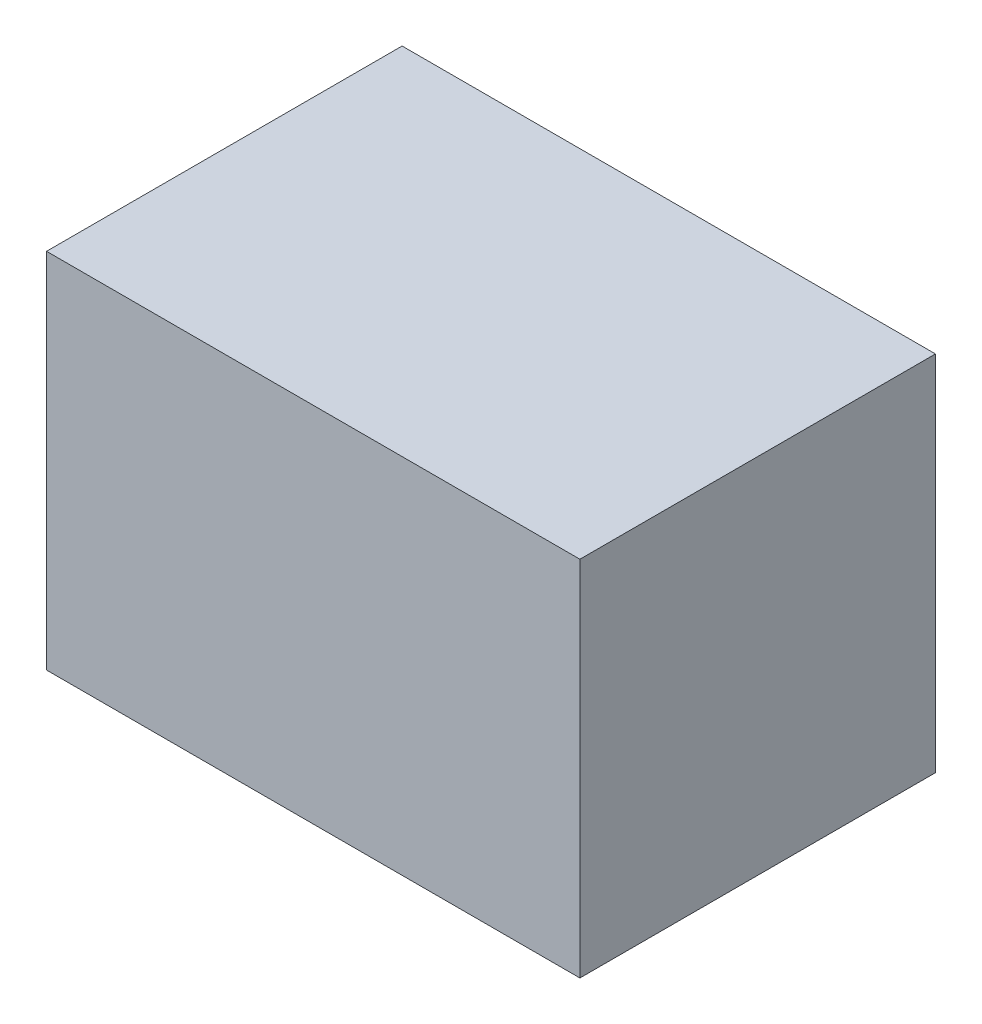
from build123d import *

# Parameters (mm, degrees)
SKETCH1_W           = 150
SKETCH1_H           = 100
BOSS_EXTRUDE1_DEPTH = 100
SHELL1_T            = -2
SKETCH3_W           = 73
SKETCH3_H           = 2
SKETCH3_W_2         = 2
SKETCH3_H_2         = 96
EXTRUDE_THIN1_DEPTH = 98
SKETCH4_R           = 15
SKETCH4_R_2         = 13.5
BOSS_EXTRUDE2_DEPTH = 75
SKETCH6_R           = 6.25
SKETCH7_R           = 6.25
SKETCH11_R          = 6.25
SKETCH11_R_2        = 5
BOSS_EXTRUDE3_DEPTH = 5
SKETCH12_R          = 6.25
BOSS_EXTRUDE4_DEPTH = 5
SKETCH13_W          = 150
SKETCH13_H          = 100
BOSS_EXTRUDE5_DEPTH = 2


with BuildPart() as part:
    # Sketch1 → Boss-Extrude1 (new body)
    with BuildSketch(Plane(origin=(0, 0, 0), x_dir=(1, 0, 0), z_dir=(0, 1, 0))):
        Rectangle(SKETCH1_W, SKETCH1_H)
    extrude(amount=BOSS_EXTRUDE1_DEPTH)

    # Shell1
    shell1_openings = [part.faces().sort_by_distance(p)[0] for p in [
        (0, 100, 0),
    ]]
    offset(amount=SHELL1_T, openings=shell1_openings, kind=Kind.INTERSECTION)

    # Sketch3 → Extrude-Thin1 (add, through all)
    with BuildSketch(Plane(origin=(0, 2, 0), x_dir=(1, 0, 0), z_dir=(0, 1, 0))):
        with Locations((-36.5, -1)):
            Rectangle(SKETCH3_W, SKETCH3_H)
        with Locations((-55.75, 0)):
            Rectangle(SKETCH3_W_2, SKETCH3_H_2)
        with Locations((-37.5, 0)):
            Rectangle(SKETCH3_W_2, SKETCH3_H_2)
        with Locations((-1, 0)):
            Rectangle(SKETCH3_W_2, SKETCH3_H_2)
        with Locations((-19.25, 0)):
            Rectangle(SKETCH3_W_2, SKETCH3_H_2)
        with Locations((35.5, 0)):
            Rectangle(SKETCH3_W_2, SKETCH3_H_2)
    extrude(amount=EXTRUDE_THIN1_DEPTH)

    # Sketch4 → Boss-Extrude2 (add)
    # profile 1 of 4: a face of its own
    with BuildSketch(Plane(origin=(0, 0, 48), x_dir=(-1, 0, 0), z_dir=(0, 0, -1))):
        with Locations((-17, 67)):
            Circle(SKETCH4_R)
        with Locations((-17, 67)):
            Circle(SKETCH4_R_2, mode=Mode.SUBTRACT)
    # profile 2 of 4: a face of its own
    with BuildSketch(Plane(origin=(0, 0, 48), x_dir=(-1, 0, 0), z_dir=(0, 0, -1))):
        with Locations((-55.5, 67)):
            Circle(SKETCH4_R)
        with Locations((-55.5, 67)):
            Circle(SKETCH4_R_2, mode=Mode.SUBTRACT)
    # profile 3 of 4: a face of its own
    with BuildSketch(Plane(origin=(0, 0, 48), x_dir=(-1, 0, 0), z_dir=(0, 0, -1))):
        with Locations((-17, 22)):
            Circle(SKETCH4_R)
        with Locations((-17, 22)):
            Circle(SKETCH4_R_2, mode=Mode.SUBTRACT)
    # profile 4 of 4: a face of its own
    with BuildSketch(Plane(origin=(0, 0, 48), x_dir=(-1, 0, 0), z_dir=(0, 0, -1))):
        with Locations((-55.5, 22)):
            Circle(SKETCH4_R)
        with Locations((-55.5, 22)):
            Circle(SKETCH4_R_2, mode=Mode.SUBTRACT)
    extrude(amount=BOSS_EXTRUDE2_DEPTH)

    # Sketch6 → section 0 of loft2
    with BuildSketch(Plane.XY.offset(-35), mode=Mode.PRIVATE) as loft2_s0:
        with Locations((17, 67)):
            Circle(SKETCH6_R)
    # loft up to a face of the part (loft2)
    loft([loft2_s0.sketch, Face(Wire([part.edges().sort_by_distance((27.268206589, 77.934529411, -27))[0]]))])

    # Sketch7 → section 1 of loft3
    with BuildSketch(Plane.XY.offset(-35), mode=Mode.PRIVATE) as loft3_s1:
        with Locations((55.5, 67)):
            Circle(SKETCH7_R)
    # loft up to a face of the part (loft3)
    loft([Face(Wire([part.edges().sort_by_distance((65.768206589, 77.934529411, -27))[0]])), loft3_s1.sketch])

    # Sketch11 → Boss-Extrude3 (add)
    with BuildSketch(Plane(origin=(0, 0, -35), x_dir=(-1, 0, 0), z_dir=(0, 0, -1))):
        with Locations((-17, 67)):
            Circle(SKETCH11_R)
        with Locations((-17, 67)):
            Circle(SKETCH11_R_2, mode=Mode.SUBTRACT)
    extrude(amount=BOSS_EXTRUDE3_DEPTH)

    # Sketch12 → Boss-Extrude4 (add)
    with BuildSketch(Plane(origin=(0, 0, -35), x_dir=(-1, 0, 0), z_dir=(0, 0, -1))):
        with Locations((-55.5, 67)):
            Circle(SKETCH12_R)
    extrude(amount=BOSS_EXTRUDE4_DEPTH)

    # Sketch13 → Boss-Extrude5 (add)
    with BuildSketch(Plane(origin=(0, 100, 0), x_dir=(1, 0, 0), z_dir=(0, 1, 0))):
        Rectangle(SKETCH13_W, SKETCH13_H)
    extrude(amount=BOSS_EXTRUDE5_DEPTH)


solid = part.part
